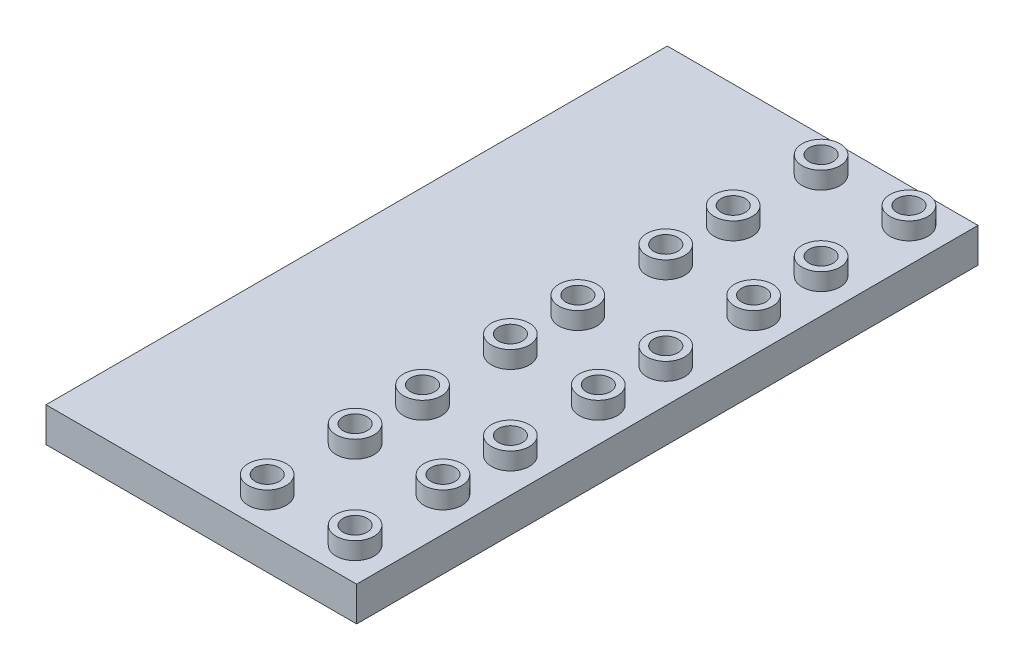
from build123d import *

# Parameters (mm, degrees)
SKETCH2_W           = 90
SKETCH2_H           = 180
BOSS_EXTRUDE1_DEPTH = 10
BOSS_EXTRUDE2_START = 10
SKETCH2_3_R         = 5.5
SKETCH2_3_R_2       = 3.5
BOSS_EXTRUDE2_DEPTH = 5


with BuildPart() as part:
    # Sketch2 → Boss-Extrude1 (new body)
    with BuildSketch(Plane(origin=(0, 0, 0), x_dir=(1, 0, 0), z_dir=(0, 1, 0))):
        Rectangle(SKETCH2_W, SKETCH2_H)
    extrude(amount=BOSS_EXTRUDE1_DEPTH)

    # Sketch2<3> → Boss-Extrude2 (add)
    # profile 1 of 16: a face of its own
    with BuildSketch(Plane(origin=(0, 0, 0), x_dir=(1, 0, 0), z_dir=(0, 1, 0)).offset(BOSS_EXTRUDE2_START)):
        with Locations(Location((9.54, -80.46, 0), (0, 0, 90))):
            Circle(SKETCH2_3_R)
        with Locations(Location((9.54, -80.46, 0), (0, 0, 90))):
            Circle(SKETCH2_3_R_2, mode=Mode.SUBTRACT)
    # profile 2 of 16: a face of its own
    with BuildSketch(Plane(origin=(0, 0, 0), x_dir=(1, 0, 0), z_dir=(0, 1, 0)).offset(BOSS_EXTRUDE2_START)):
        with Locations(Location((35, -80.46, 0), (0, 0, 90))):
            Circle(SKETCH2_3_R)
        with Locations(Location((35, -80.46, 0), (0, 0, 90))):
            Circle(SKETCH2_3_R_2, mode=Mode.SUBTRACT)
    # profile 3 of 16: a face of its own
    with BuildSketch(Plane(origin=(0, 0, 0), x_dir=(1, 0, 0), z_dir=(0, 1, 0)).offset(BOSS_EXTRUDE2_START)):
        with Locations(Location((9.54, -55, 0), (0, 0, 90))):
            Circle(SKETCH2_3_R)
        with Locations(Location((9.54, -55, 0), (0, 0, 90))):
            Circle(SKETCH2_3_R_2, mode=Mode.SUBTRACT)
    # profile 4 of 16: a face of its own
    with BuildSketch(Plane(origin=(0, 0, 0), x_dir=(1, 0, 0), z_dir=(0, 1, 0)).offset(BOSS_EXTRUDE2_START)):
        with Locations(Location((35, -55, 0), (0, 0, 90))):
            Circle(SKETCH2_3_R)
        with Locations(Location((35, -55, 0), (0, 0, 90))):
            Circle(SKETCH2_3_R_2, mode=Mode.SUBTRACT)
    # profile 5 of 16: a face of its own
    with BuildSketch(Plane(origin=(0, 0, 0), x_dir=(1, 0, 0), z_dir=(0, 1, 0)).offset(BOSS_EXTRUDE2_START)):
        with Locations(Location((9.54, -35.46, 0), (0, 0, 90))):
            Circle(SKETCH2_3_R)
        with Locations(Location((9.54, -35.46, 0), (0, 0, 90))):
            Circle(SKETCH2_3_R_2, mode=Mode.SUBTRACT)
    # profile 6 of 16: a face of its own
    with BuildSketch(Plane(origin=(0, 0, 0), x_dir=(1, 0, 0), z_dir=(0, 1, 0)).offset(BOSS_EXTRUDE2_START)):
        with Locations(Location((35, -35.46, 0), (0, 0, 90))):
            Circle(SKETCH2_3_R)
        with Locations(Location((35, -35.46, 0), (0, 0, 90))):
            Circle(SKETCH2_3_R_2, mode=Mode.SUBTRACT)
    # profile 7 of 16: a face of its own
    with BuildSketch(Plane(origin=(0, 0, 0), x_dir=(1, 0, 0), z_dir=(0, 1, 0)).offset(BOSS_EXTRUDE2_START)):
        with Locations(Location((9.54, -10, 0), (0, 0, 90))):
            Circle(SKETCH2_3_R)
        with Locations(Location((9.54, -10, 0), (0, 0, 90))):
            Circle(SKETCH2_3_R_2, mode=Mode.SUBTRACT)
    # profile 8 of 16: a face of its own
    with BuildSketch(Plane(origin=(0, 0, 0), x_dir=(1, 0, 0), z_dir=(0, 1, 0)).offset(BOSS_EXTRUDE2_START)):
        with Locations(Location((35, -10, 0), (0, 0, 90))):
            Circle(SKETCH2_3_R)
        with Locations(Location((35, -10, 0), (0, 0, 90))):
            Circle(SKETCH2_3_R_2, mode=Mode.SUBTRACT)
    # profile 9 of 16: a face of its own
    with BuildSketch(Plane(origin=(0, 0, 0), x_dir=(1, 0, 0), z_dir=(0, 1, 0)).offset(BOSS_EXTRUDE2_START)):
        with Locations(Location((9.54, 9.54, 0), (0, 0, 90))):
            Circle(SKETCH2_3_R)
        with Locations(Location((9.54, 9.54, 0), (0, 0, 90))):
            Circle(SKETCH2_3_R_2, mode=Mode.SUBTRACT)
    # profile 10 of 16: a face of its own
    with BuildSketch(Plane(origin=(0, 0, 0), x_dir=(1, 0, 0), z_dir=(0, 1, 0)).offset(BOSS_EXTRUDE2_START)):
        with Locations(Location((35, 9.54, 0), (0, 0, 90))):
            Circle(SKETCH2_3_R)
        with Locations(Location((35, 9.54, 0), (0, 0, 90))):
            Circle(SKETCH2_3_R_2, mode=Mode.SUBTRACT)
    # profile 11 of 16: a face of its own
    with BuildSketch(Plane(origin=(0, 0, 0), x_dir=(1, 0, 0), z_dir=(0, 1, 0)).offset(BOSS_EXTRUDE2_START)):
        with Locations(Location((9.54, 35, 0), (0, 0, 90))):
            Circle(SKETCH2_3_R)
        with Locations(Location((9.54, 35, 0), (0, 0, 90))):
            Circle(SKETCH2_3_R_2, mode=Mode.SUBTRACT)
    # profile 12 of 16: a face of its own
    with BuildSketch(Plane(origin=(0, 0, 0), x_dir=(1, 0, 0), z_dir=(0, 1, 0)).offset(BOSS_EXTRUDE2_START)):
        with Locations(Location((35, 35, 0), (0, 0, 90))):
            Circle(SKETCH2_3_R)
        with Locations(Location((35, 35, 0), (0, 0, 90))):
            Circle(SKETCH2_3_R_2, mode=Mode.SUBTRACT)
    # profile 13 of 16: a face of its own
    with BuildSketch(Plane(origin=(0, 0, 0), x_dir=(1, 0, 0), z_dir=(0, 1, 0)).offset(BOSS_EXTRUDE2_START)):
        with Locations(Location((9.54, 54.54, 0), (0, 0, 90))):
            Circle(SKETCH2_3_R)
        with Locations(Location((9.54, 54.54, 0), (0, 0, 90))):
            Circle(SKETCH2_3_R_2, mode=Mode.SUBTRACT)
    # profile 14 of 16: a face of its own
    with BuildSketch(Plane(origin=(0, 0, 0), x_dir=(1, 0, 0), z_dir=(0, 1, 0)).offset(BOSS_EXTRUDE2_START)):
        with Locations(Location((35, 54.54, 0), (0, 0, 90))):
            Circle(SKETCH2_3_R)
        with Locations(Location((35, 54.54, 0), (0, 0, 90))):
            Circle(SKETCH2_3_R_2, mode=Mode.SUBTRACT)
    # profile 15 of 16: a face of its own
    with BuildSketch(Plane(origin=(0, 0, 0), x_dir=(1, 0, 0), z_dir=(0, 1, 0)).offset(BOSS_EXTRUDE2_START)):
        with Locations(Location((9.54, 80, 0), (0, 0, 90))):
            Circle(SKETCH2_3_R)
        with Locations(Location((9.54, 80, 0), (0, 0, 90))):
            Circle(SKETCH2_3_R_2, mode=Mode.SUBTRACT)
    # profile 16 of 16: a face of its own
    with BuildSketch(Plane(origin=(0, 0, 0), x_dir=(1, 0, 0), z_dir=(0, 1, 0)).offset(BOSS_EXTRUDE2_START)):
        with Locations(Location((35, 80, 0), (0, 0, 90))):
            Circle(SKETCH2_3_R)
        with Locations(Location((35, 80, 0), (0, 0, 90))):
            Circle(SKETCH2_3_R_2, mode=Mode.SUBTRACT)
    extrude(amount=BOSS_EXTRUDE2_DEPTH)


solid = part.part
